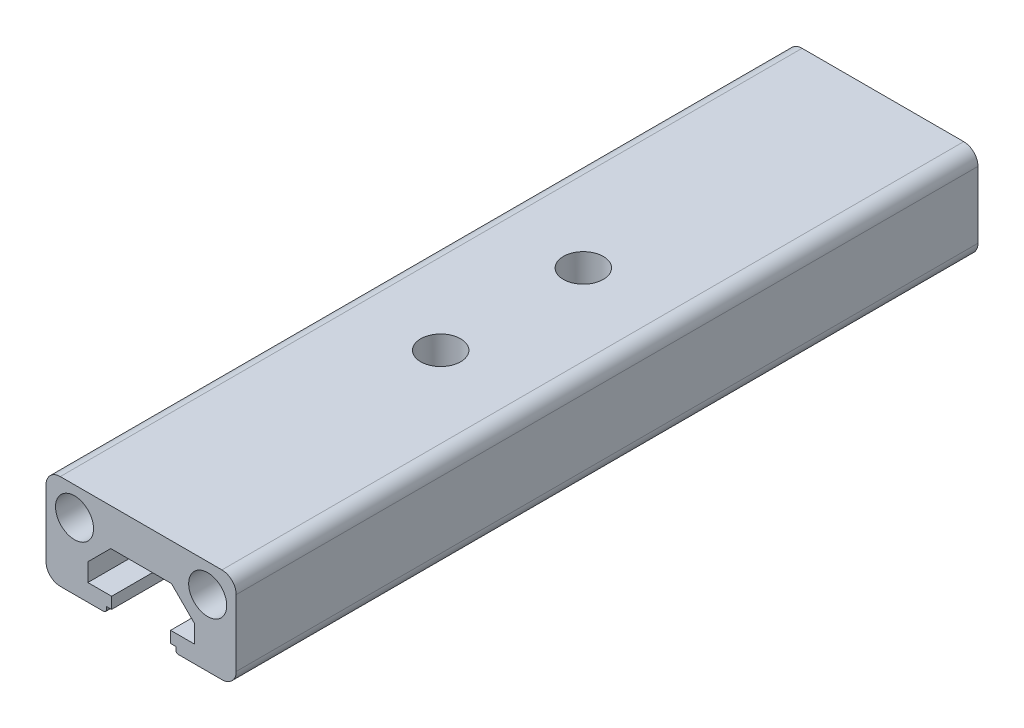
from build123d import *

# Parameters (mm, degrees)
SKETCH_1_R               = 2
EXTRUDE_1_DEPTH          = 39
CUT_EXTRUDE_1_DEPTH      = 42.484937025
CUT_EXTRUDE_1_DEPTH_BACK = 42.484937025
SKETCH_2_R               = 2.1


with BuildPart() as part:
    # 草图1 → 凸台-拉伸1 (new, symmetric)
    with BuildSketch(Plane.XY):
        with BuildLine():
            Line((-8.5, 0), (-3.95, 0))
            ThreePointArc((-3.95, 0), (-3.737867966, 0.087867966), (-3.65, 0.3))
            Line((-3.65, 0.3), (-3.65, 0.6))
            Line((-3.65, 0.6), (-3.1, 0.6))
            Line((-3.1, 0.6), (-3.1, 1.8))
            Line((-3.1, 1.8), (-5.6, 1.8))
            Line((-5.6, 1.8), (-5.6, 3.692893219))
            Line((-5.6, 3.692893219), (-3.192893219, 6.1))
            Line((-3.192893219, 6.1), (3.192893219, 6.1))
            Line((3.192893219, 6.1), (5.6, 3.692893219))
            Line((5.6, 3.692893219), (5.6, 1.8))
            Line((5.6, 1.8), (3.1, 1.8))
            Line((3.1, 1.8), (3.1, 0.6))
            Line((3.1, 0.6), (3.65, 0.6))
            Line((3.65, 0.6), (3.65, 0.3))
            ThreePointArc((3.65, 0.3), (3.737867966, 0.087867966), (3.95, 0))
            Line((3.95, 0), (8.5, 0))
            ThreePointArc((8.5, 0), (9.560660172, 0.439339828), (10, 1.5))
            Line((10, 1.5), (10, 8.5))
            ThreePointArc((10, 8.5), (9.560660172, 9.560660172), (8.5, 10))
            Line((8.5, 10), (-8.5, 10))
            ThreePointArc((-8.5, 10), (-9.560660172, 9.560660172), (-10, 8.5))
            Line((-10, 8.5), (-10, 1.5))
            ThreePointArc((-10, 1.5), (-9.560660172, 0.439339828), (-8.5, 0))
        make_face()
        with Locations((-7, 7)):
            Circle(SKETCH_1_R, mode=Mode.SUBTRACT)
        with Locations(Location((7, 7, 0), (0, 0, 180))):
            Circle(SKETCH_1_R, mode=Mode.SUBTRACT)
    extrude(amount=EXTRUDE_1_DEPTH, both=True)

    # 草图2 → 切除-拉伸1 (cut, two sides: drawn at the far end of the back side and taken through both)
    with BuildSketch(Plane(origin=(0, 10, 0), x_dir=(1, 0, 0), z_dir=(0, 1, 0)).offset(-CUT_EXTRUDE_1_DEPTH_BACK)):
        with Locations(Location((0, 7.5, 0), (0, 0, 270))):
            Circle(SKETCH_2_R)
        with Locations(Location((0, -7.5, 0), (0, 0, 270))):
            Circle(SKETCH_2_R)
    extrude(amount=CUT_EXTRUDE_1_DEPTH + CUT_EXTRUDE_1_DEPTH_BACK, mode=Mode.SUBTRACT)


solid = part.part
